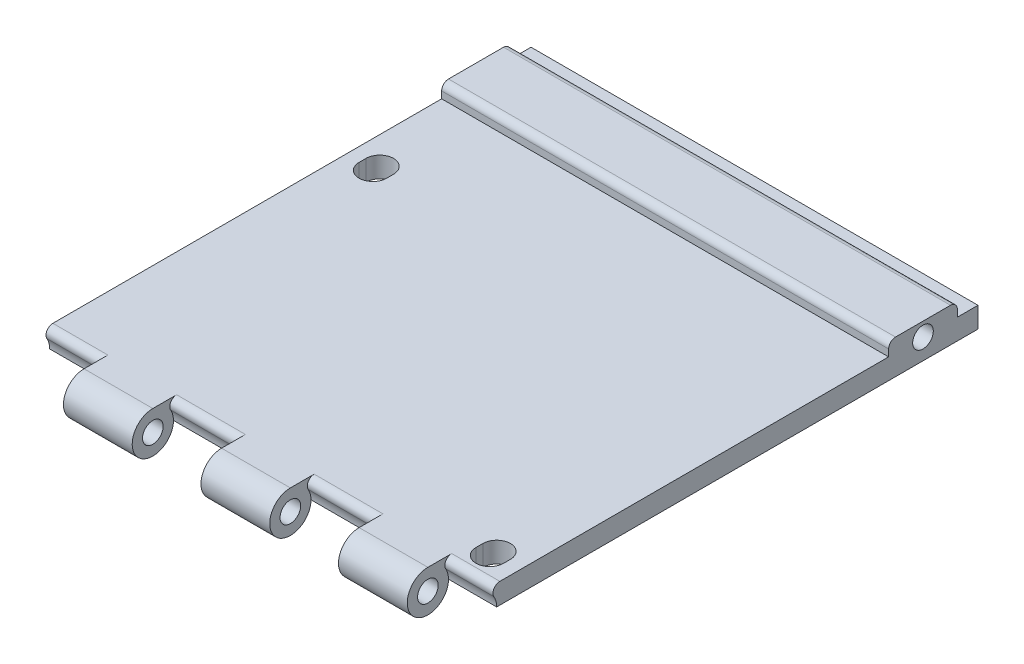
from build123d import *

# Parameters (mm, degrees)
BOSS_EXTRUDE1_DEPTH = 3
SKETCH2_R           = 3.0000000000000013
BOSS_EXTRUDE2_DEPTH = 65
SKETCH14_R          = 2.999999999999994
CUT_EXTRUDE1_DEPTH  = 8
SKETCH15_R          = 2.999999999999994
CUT_EXTRUDE2_DEPTH  = 10
SKETCH16_R          = 2.999999999999994
CUT_EXTRUDE3_DEPTH  = 10
SKETCH17_R          = 3.0000000000000013
CUT_EXTRUDE4_DEPTH  = 7
CUT_EXTRUDE5_DEPTH  = 7
SKETCH19_R          = 3.0000000000000013
BOSS_EXTRUDE3_DEPTH = 65
SKETCH13_R          = 1.500000000000004
CUT_EXTRUDE7_DEPTH  = 77.29711659034044
SKETCH20_R          = 1.5000000000000042
CUT_EXTRUDE8_DEPTH  = 77.29711659034045
FILLET1_R           = 1
SKETCH21_R          = 1.5000000000000075
BOSS_EXTRUDE4_DEPTH = 65
SKETCH22_W          = 5.918541019528025
SKETCH22_H          = 2.806652575268912
CUT_EXTRUDE9_DEPTH  = 77.29711659034044


with BuildPart() as part:
    # Sketch1 → Boss-Extrude1 (new body)
    with BuildSketch(Plane(origin=(0, 0, 0), x_dir=(1, 0, 0), z_dir=(0, 1, 0))):
        Polygon((-32.50000000000001, 36.49999999999999), (32.49999999999999, 36.49999999999999), (32.500000000000014, -36.50000000000001), (-32.5, -36.50000000000001), align=None)
    extrude(amount=BOSS_EXTRUDE1_DEPTH)

    # Sketch2 → Boss-Extrude2 (add, through all)
    with BuildSketch(Plane(origin=(32.5, 0, -9.27e-15), x_dir=(0, 0, -1), z_dir=(1, 0, 0))):
        with Locations((-36.500000000000014, 0)):
            Circle(SKETCH2_R)
    extrude(amount=-BOSS_EXTRUDE2_DEPTH)

    # Sketch14 → Cut-Extrude1 (cut)
    with BuildSketch(Plane.ZY.offset(24.500000000000004)):
        with Locations((36.500000000000014, 0)):
            Circle(SKETCH14_R)
    extrude(amount=CUT_EXTRUDE1_DEPTH, mode=Mode.SUBTRACT)

    # Sketch15 → Cut-Extrude2 (cut)
    with BuildSketch(Plane.ZY.offset(4.5000000000000036)):
        with Locations((36.500000000000014, 0)):
            Circle(SKETCH15_R)
    extrude(amount=CUT_EXTRUDE2_DEPTH, mode=Mode.SUBTRACT)

    # Sketch16 → Cut-Extrude3 (cut)
    with BuildSketch(Plane.ZY.offset(-15.499999999999996)):
        with Locations((36.500000000000014, 0)):
            Circle(SKETCH16_R)
    extrude(amount=CUT_EXTRUDE3_DEPTH, mode=Mode.SUBTRACT)

    # Sketch17 → Cut-Extrude4 (cut)
    with BuildSketch(Plane(origin=(32.5, 0, -9.27e-15), x_dir=(-1.9e-16, 0, -1), z_dir=(1, 0, -1.9e-16))):
        with Locations((-36.500000000000014, 0)):
            Circle(SKETCH17_R)
    extrude(amount=-CUT_EXTRUDE4_DEPTH, mode=Mode.SUBTRACT)

    # Sketch18 → Cut-Extrude5 (cut)
    with BuildSketch(Plane(origin=(0, 3, 0), x_dir=(1, 0, 0), z_dir=(0, 1, 0))):
        with BuildLine():
            Line((-30.50000000000002, 10.499999999999995), (-30.50000000000002, 9.500000000000002))
            ThreePointArc((-30.50000000000002, 9.500000000000002), (-28.500000000000018, 7.499999999999998), (-26.500000000000018, 9.500000000000002))
            Line((-26.500000000000018, 9.500000000000002), (-26.500000000000018, 10.499999999999995))
            ThreePointArc((-26.500000000000018, 10.499999999999995), (-28.500000000000018, 12.499999999999995), (-30.50000000000002, 10.499999999999995))
        make_face()
        with BuildLine():
            Line((26.5, -29.500000000000007), (26.5, -30.5))
            ThreePointArc((26.5, -30.5), (28.499999999999993, -32.49999999999999), (30.49999999999999, -30.5))
            Line((30.49999999999999, -30.5), (30.49999999999999, -29.500000000000007))
            ThreePointArc((30.49999999999999, -29.500000000000007), (28.499999999999993, -27.50000000000001), (26.5, -29.500000000000007))
        make_face()
    extrude(amount=-CUT_EXTRUDE5_DEPTH, mode=Mode.SUBTRACT)

    # Sketch19 → Boss-Extrude3 (add)
    with BuildSketch(Plane.ZY.offset(32.50000000000001)):
        with Locations((-28.500000000000004, 2.999999999999999)):
            Circle(SKETCH19_R)
    extrude(amount=-BOSS_EXTRUDE3_DEPTH)

    # Sketch13 → Cut-Extrude7 (cut, through all)
    with BuildSketch(Plane(origin=(32.5, 0, -9.27e-15), x_dir=(0, 0, -1), z_dir=(1, 0, 0))):
        with Locations((-36.500000000000014, 0)):
            Circle(SKETCH13_R)
    extrude(amount=-CUT_EXTRUDE7_DEPTH, mode=Mode.SUBTRACT)

    # Sketch20 → Cut-Extrude8 (cut, through all)
    with BuildSketch(Plane.ZY.offset(32.50000000000001)):
        with Locations((-28.5, 2.999999999999999)):
            Circle(SKETCH20_R)
    extrude(amount=-CUT_EXTRUDE8_DEPTH, mode=Mode.SUBTRACT)

    # Fillet1
    fillet1_edges = [part.edges().sort_by_distance(p)[0] for p in [
        (-28.5, 3, 36.50000000000001),
        (-9.5, 3, 36.50000000000001),
        (10.500000000000004, 3, 36.50000000000001),
        (29.00000000000001, 3, 36.50000000000001),
    ]]
    fillet(fillet1_edges, radius=FILLET1_R)

    # Sketch21 → Boss-Extrude4 (add, through all)
    with BuildSketch(Plane.ZY.offset(32.50000000000001)):
        with BuildLine():
            Line((-33.50000000000001, 0), (-23.500000000000007, 0))
            Line((-23.500000000000007, 0), (-23.500000000000007, 3.9999999999999933))
            ThreePointArc((-23.500000000000007, 3.9999999999999933), (-23.79289321881346, 4.707106781186548), (-24.500000000000014, 5))
            Line((-24.500000000000014, 5), (-32.5, 5))
            ThreePointArc((-32.5, 5), (-33.20710678118655, 4.707106781186548), (-33.50000000000001, 3.9999999999999933))
            Line((-33.50000000000001, 3.9999999999999933), (-33.50000000000001, 0))
        make_face()
        with Locations((-28.500000000000004, 2.999999999999999)):
            Circle(SKETCH21_R, mode=Mode.SUBTRACT)
    extrude(amount=-BOSS_EXTRUDE4_DEPTH)

    # Sketch22 → Cut-Extrude9 (cut, through all)
    with BuildSketch(Plane(origin=(32.5, 0, -9.27e-15), x_dir=(-2.9e-16, 0, -1), z_dir=(1, 0, -2.9e-16))):
        with Locations((28.341236521014125, 6.4033262876344565)):
            Rectangle(SKETCH22_W, SKETCH22_H)
    extrude(amount=-CUT_EXTRUDE9_DEPTH, mode=Mode.SUBTRACT)


solid = part.part
